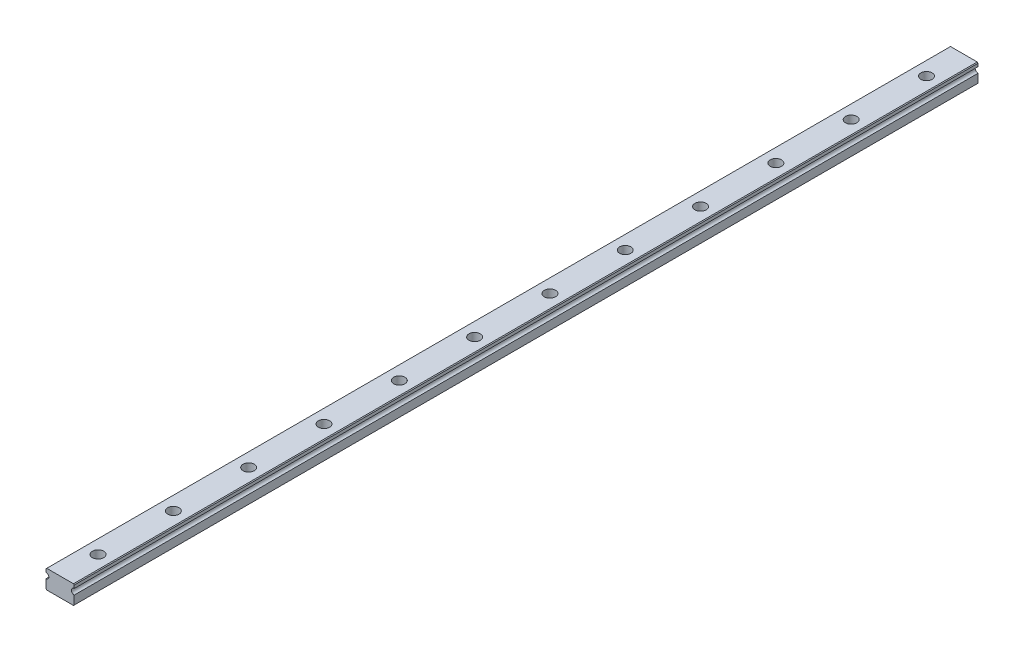
from build123d import *

# Parameters (mm, degrees)
EXTRUDE_1_DEPTH        = 1000
SKETCH_2_R             = 1.5
CUT_EXTRUDE_1_DEPTH    = 20
SKETCH_3_R             = 3
CUT_EXTRUDE_2_DEPTH    = 4.5
PATTERN_LINEAR_1_COUNT = 25
PATTERN_LINEAR_1_PITCH = 40
CUT_EXTRUDE_4_DEPTH    = 80
CUT_EXTRUDE_5_DEPTH    = 80
CUT_EXTRUDE_START      = -360
CUT_EXTRUDE_7_DEPTH    = 360


with BuildPart() as part:
    # 草图1 → 凸台-拉伸1 (new body)
    with BuildSketch(Plane.XY):
        with BuildLine():
            Line((-7.643186957, 0.234233912), (-7.643186957, -4.365766088))
            Line((-7.643186957, -4.365766088), (-7.243186957, -4.765766088))
            Line((-7.243186957, -4.765766088), (6.956813043, -4.765766088))
            Line((6.956813043, -4.765766088), (7.356813043, -4.365766088))
            Line((7.356813043, -4.365766088), (7.356813043, 0.234233912))
            ThreePointArc((7.356813043, 0.234233912), (6.296152871, 0.67357374), (5.856813043, 1.734233912))
            ThreePointArc((5.856813043, 1.734233912), (6.296152871, 2.794894084), (7.356813043, 3.234233912))
            Line((7.356813043, 3.234233912), (7.356813043, 4.834233912))
            Line((7.356813043, 4.834233912), (6.956813043, 5.234233912))
            Line((6.956813043, 5.234233912), (-7.243186957, 5.234233912))
            Line((-7.243186957, 5.234233912), (-7.643186957, 4.834233912))
            Line((-7.643186957, 4.834233912), (-7.643186957, 3.234233912))
            ThreePointArc((-7.643186957, 3.234233912), (-6.143186957, 1.734233912), (-7.643186957, 0.234233912))
        make_face()
    extrude(amount=EXTRUDE_1_DEPTH)

    # 草图2 → 切除-拉伸1 (cut)
    with BuildSketch(Plane(origin=(0, 5.234233912, 0), x_dir=(1, 0, 0), z_dir=(0, 1, 0))):
        with Locations(Location((0, -20, 0), (0, 0, 270))):
            Circle(SKETCH_2_R)
    cut_extrude_1 = extrude(amount=-CUT_EXTRUDE_1_DEPTH, mode=Mode.SUBTRACT)

    # 草图3 → 切除-拉伸2 (cut)
    with BuildSketch(Plane(origin=(0, 5.234233912, 0), x_dir=(1, 0, 0), z_dir=(0, 1, 0))):
        with Locations(Location((0, -20, 0), (0, 0, 270))):
            Circle(SKETCH_3_R)
    cut_extrude_2 = extrude(amount=-CUT_EXTRUDE_2_DEPTH, mode=Mode.SUBTRACT)

    # 阵列(线性)1: 切除-拉伸1, 切除-拉伸2 ×25
    with Locations(*[(0, 0, i * PATTERN_LINEAR_1_PITCH) for i in range(1, PATTERN_LINEAR_1_COUNT)]):
        add(cut_extrude_1, mode=Mode.SUBTRACT)
        add(cut_extrude_2, mode=Mode.SUBTRACT)

    # 草图6 → 切除-拉伸4 (cut)
    with BuildSketch(Plane(origin=(0, 0, 0), x_dir=(-1, 0, 0), z_dir=(0, 0, -1))):
        with BuildLine():
            Line((7.643186957, 3.234233912), (7.643186957, 4.834233912))
            Line((7.643186957, 4.834233912), (7.243186957, 5.234233912))
            Line((7.243186957, 5.234233912), (-6.956813043, 5.234233912))
            Line((-6.956813043, 5.234233912), (-7.356813043, 4.834233912))
            Line((-7.356813043, 4.834233912), (-7.356813043, 3.234233912))
            ThreePointArc((-7.356813043, 3.234233912), (-5.856813043, 1.734233912), (-7.356813043, 0.234233912))
            Line((-7.356813043, 0.234233912), (-7.356813043, -4.365766088))
            Line((-7.356813043, -4.365766088), (-6.956813043, -4.765766088))
            Line((-6.956813043, -4.765766088), (7.243186957, -4.765766088))
            Line((7.243186957, -4.765766088), (7.643186957, -4.365766088))
            Line((7.643186957, -4.365766088), (7.643186957, 0.234233912))
            ThreePointArc((7.643186957, 0.234233912), (6.143186957, 1.734233912), (7.643186957, 3.234233912))
        make_face()
    extrude(amount=-CUT_EXTRUDE_4_DEPTH, mode=Mode.SUBTRACT)

    # 草图7 → 切除-拉伸5 (cut)
    with BuildSketch(Plane(origin=(0, 0, 80), x_dir=(-1, 0, 0), z_dir=(0, 0, -1))):
        with BuildLine():
            Line((7.643186957, 3.234233912), (7.643186957, 4.834233912))
            Line((7.643186957, 4.834233912), (7.243186957, 5.234233912))
            Line((7.243186957, 5.234233912), (-6.956813043, 5.234233912))
            Line((-6.956813043, 5.234233912), (-7.356813043, 4.834233912))
            Line((-7.356813043, 4.834233912), (-7.356813043, 3.234233912))
            ThreePointArc((-7.356813043, 3.234233912), (-5.856813043, 1.734233912), (-7.356813043, 0.234233912))
            Line((-7.356813043, 0.234233912), (-7.356813043, -4.365766088))
            Line((-7.356813043, -4.365766088), (-6.956813043, -4.765766088))
            Line((-6.956813043, -4.765766088), (7.243186957, -4.765766088))
            Line((7.243186957, -4.765766088), (7.643186957, -4.365766088))
            Line((7.643186957, -4.365766088), (7.643186957, 0.234233912))
            ThreePointArc((7.643186957, 0.234233912), (6.143186957, 1.734233912), (7.643186957, 3.234233912))
        make_face()
    extrude(amount=-CUT_EXTRUDE_5_DEPTH, mode=Mode.SUBTRACT)

    # 草图9 → 切除-拉伸7 (cut)
    with BuildSketch(Plane.XY.offset(1000).offset(CUT_EXTRUDE_START)):
        with BuildLine():
            Line((-7.643186957, 0.234233912), (-7.643186957, -4.365766088))
            Line((-7.643186957, -4.365766088), (-7.243186957, -4.765766088))
            Line((-7.243186957, -4.765766088), (6.956813043, -4.765766088))
            Line((6.956813043, -4.765766088), (7.356813043, -4.365766088))
            Line((7.356813043, -4.365766088), (7.356813043, 0.234233912))
            ThreePointArc((7.356813043, 0.234233912), (5.856813043, 1.734233912), (7.356813043, 3.234233912))
            Line((7.356813043, 3.234233912), (7.356813043, 4.834233912))
            Line((7.356813043, 4.834233912), (6.956813043, 5.234233912))
            Line((6.956813043, 5.234233912), (-7.243186957, 5.234233912))
            Line((-7.243186957, 5.234233912), (-7.643186957, 4.834233912))
            Line((-7.643186957, 4.834233912), (-7.643186957, 3.234233912))
            ThreePointArc((-7.643186957, 3.234233912), (-6.143186957, 1.734233912), (-7.643186957, 0.234233912))
        make_face()
    extrude(amount=CUT_EXTRUDE_7_DEPTH, mode=Mode.SUBTRACT)


solid = part.part
